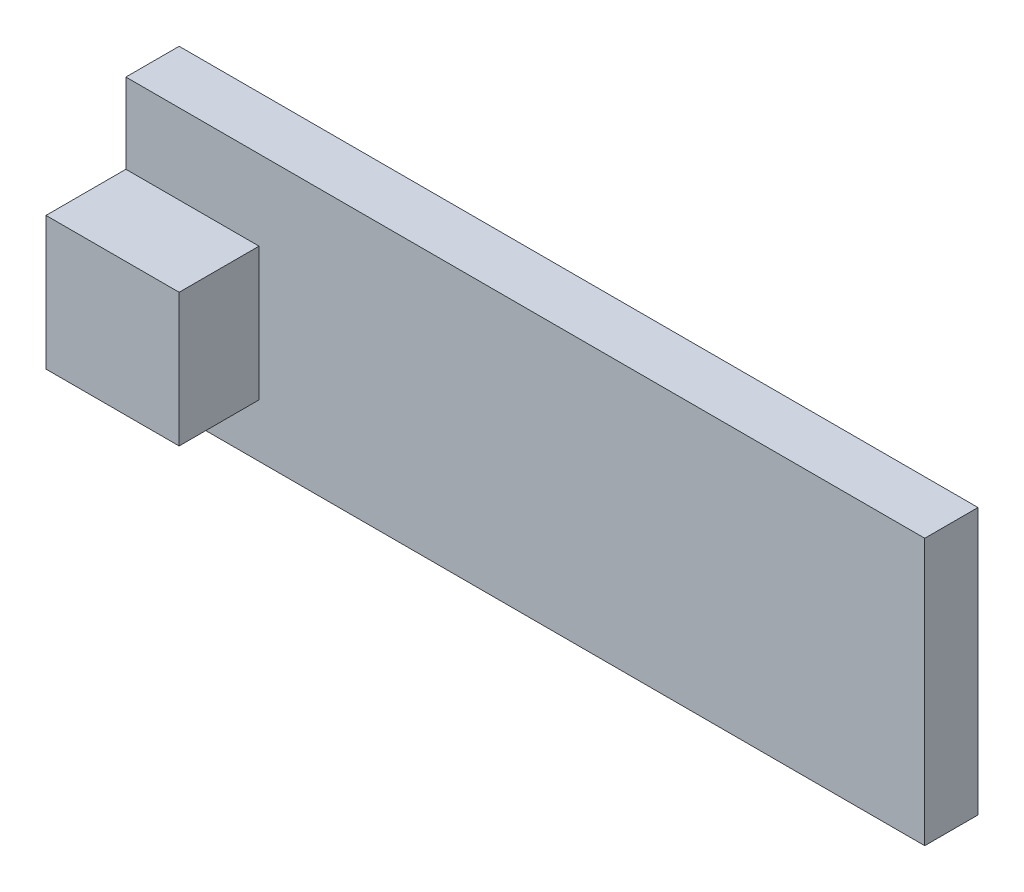
from build123d import *

# Parameters (mm, degrees)
SKETCH_1_W      = 30
SKETCH_1_H      = 10
EXTRUDE_1_DEPTH = 2
SKETCH_2_W      = 5
SKETCH_2_H      = 5
EXTRUDE_2_DEPTH = 3


with BuildPart() as part:
    # 草图1 → 凸台-拉伸1 (new body)
    with BuildSketch(Plane.XY):
        with Locations((15, 5)):
            Rectangle(SKETCH_1_W, SKETCH_1_H)
    extrude(amount=EXTRUDE_1_DEPTH)


with BuildPart() as body_2:
    # 草图2 → 凸台-拉伸2 (new body)
    with BuildSketch(Plane.XY.offset(2)):
        with Locations((2.5, 4.5)):
            Rectangle(SKETCH_2_W, SKETCH_2_H)
    extrude(amount=EXTRUDE_2_DEPTH)


solid = Compound([part.part, body_2.part])
